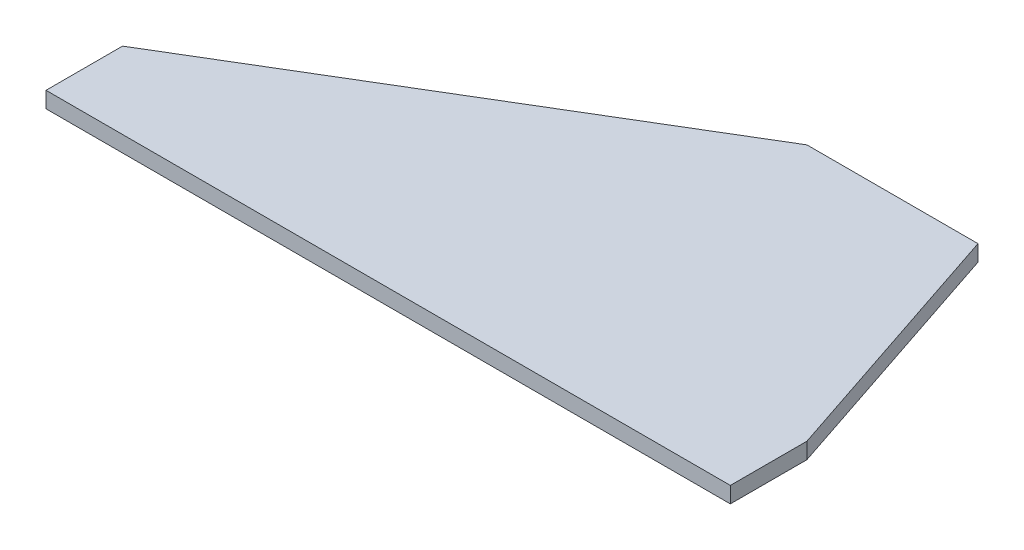
from build123d import *

# Parameters (mm, degrees)
BOSS_EXTRUDE1_DEPTH      = 2.38125
BOSS_EXTRUDE1_DEPTH_BACK = 2.38125


with BuildPart() as part:
    # Sketch1 → Boss-Extrude1 (new, two sides: drawn at the far end of the back side and taken through both)
    with BuildSketch(Plane(origin=(0, 0, 0), x_dir=(1, 0, 0), z_dir=(0, 1, 0)).offset(-BOSS_EXTRUDE1_DEPTH_BACK)):
        Polygon((0, 0), (0, 22.733), (127, 98.933), (177.8, 98.933), (203.2, 22.733), (203.2, 0), align=None)
    extrude(amount=BOSS_EXTRUDE1_DEPTH + BOSS_EXTRUDE1_DEPTH_BACK)


solid = part.part
